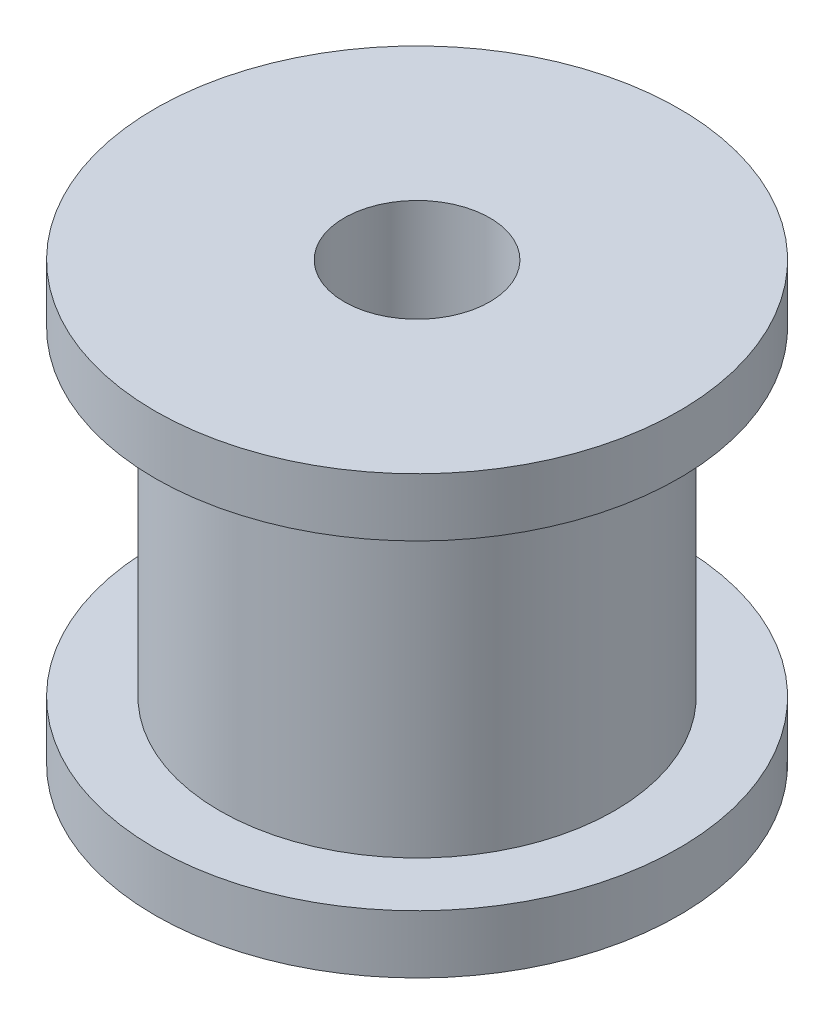
from build123d import *

# Parameters (mm, degrees)
SKETCH_1_R          = 9
EXTRUDE_1_DEPTH     = 2
SKETCH_2_R          = 6.78
EXTRUDE_2_DEPTH     = 11
SKETCH_3_R          = 9
EXTRUDE_3_DEPTH     = 2
SKETCH_4_R          = 2.5
CUT_EXTRUDE_1_DEPTH = 26


with BuildPart() as part:
    # 草图1 → 凸台-拉伸1 (new body)
    with BuildSketch(Plane(origin=(0, 0, 0), x_dir=(1, 0, 0), z_dir=(0, 1, 0))):
        with Locations(Location((0, 0, 0), (0, 0, 270))):
            Circle(SKETCH_1_R)
    extrude(amount=EXTRUDE_1_DEPTH)

    # 草图2 → 凸台-拉伸2 (add)
    with BuildSketch(Plane(origin=(0, 2, 0), x_dir=(1, 0, 0), z_dir=(0, 1, 0))):
        with Locations(Location((0, 0, 0), (0, 0, 270))):
            Circle(SKETCH_2_R)
    extrude(amount=EXTRUDE_2_DEPTH)

    # 草图3 → 凸台-拉伸3 (add)
    with BuildSketch(Plane(origin=(0, 13, 0), x_dir=(1, 0, 0), z_dir=(0, 1, 0))):
        with Locations(Location((0, 0, 0), (0, 0, 270))):
            Circle(SKETCH_3_R)
    extrude(amount=EXTRUDE_3_DEPTH)

    # 草图4 → 切除-拉伸1 (cut)
    with BuildSketch(Plane(origin=(0, 15, 0), x_dir=(1, 0, 0), z_dir=(0, 1, 0))):
        with Locations(Location((0, 0, 0), (0, 0, 270))):
            Circle(SKETCH_4_R)
    extrude(amount=-CUT_EXTRUDE_1_DEPTH, mode=Mode.SUBTRACT)


solid = part.part
